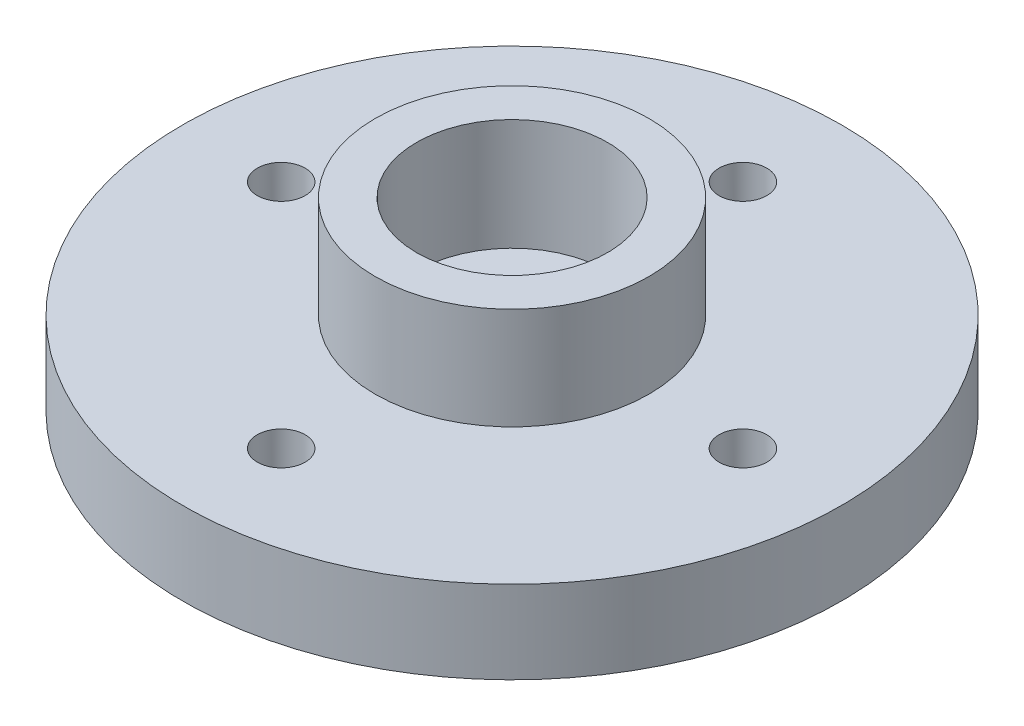
from build123d import *

# Parameters (mm, degrees)
SKETCH_2_R          = 3
SKETCH_2_R_2        = 0.75
CUT_EXTRUDE_1_DEPTH = 10
EXTRUDE_START       = -3.5
SKETCH_3_R          = 3
SKETCH_3_R_2        = 1.5
EXTRUDE_1_DEPTH     = 2.9


with BuildPart() as part:
    # 草图1 → 旋转1 (revolve)
    with BuildSketch(Plane.XY, mode=Mode.PRIVATE) as revolve_1_sk:
        Polygon((0, -0.6), (-3.55, -0.6), (-4.836704152, 0), (-10.35, 0), (-10.35, 2.6), (-4.3, 2.6), (-4.3, 5.8), (0, 5.8), align=None)
    revolve(revolve_1_sk.sketch.rotate(Axis((0, 0, 0), (0, 1, 0)), 270), axis=Axis((0, 0, 0), (0, 1, 0)))

    # 草图2 → 切除-拉伸1 (cut)
    with BuildSketch(Plane(origin=(0, 5.8, 0), x_dir=(1, 0, 0), z_dir=(0, 1, 0))):
        with Locations(Location((0, 0, 0), (0, 0, 270))):
            Circle(SKETCH_2_R)
        with Locations(Location((0, 7.25, 0), (0, 0, 270))):
            Circle(SKETCH_2_R_2)
        with Locations(Location((7.25, 0, 0), (0, 0, 270))):
            Circle(SKETCH_2_R_2)
        with Locations(Location((0, -7.25, 0), (0, 0, 270))):
            Circle(SKETCH_2_R_2)
        with Locations(Location((-7.25, 0, 0), (0, 0, 270))):
            Circle(SKETCH_2_R_2)
    extrude(amount=-CUT_EXTRUDE_1_DEPTH, mode=Mode.SUBTRACT)

    # 草图3 → 凸台-拉伸1 (add)
    with BuildSketch(Plane(origin=(0, 5.8, 0), x_dir=(1, 0, 0), z_dir=(0, 1, 0)).offset(EXTRUDE_START)):
        with Locations(Location((0, 0, 0), (0, 0, 270))):
            Circle(SKETCH_3_R)
        with Locations(Location((0, 0, 0), (0, 0, 270))):
            Circle(SKETCH_3_R_2, mode=Mode.SUBTRACT)
    extrude(amount=-EXTRUDE_1_DEPTH)


solid = part.part
